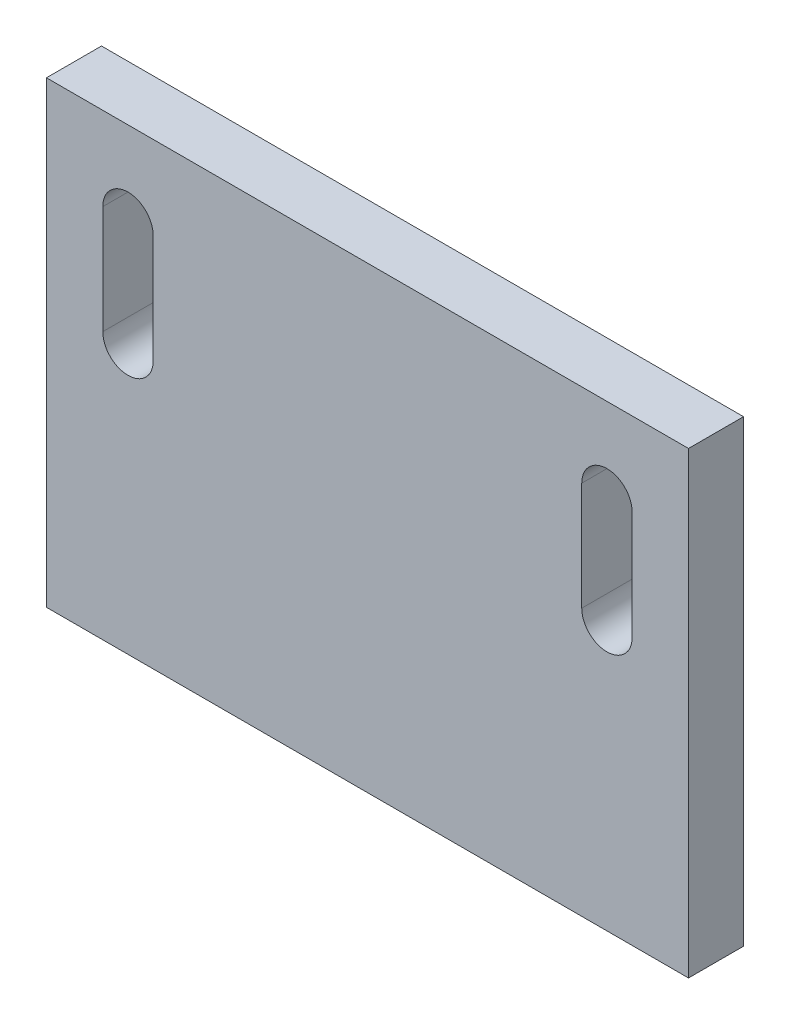
from build123d import *

# Parameters (mm, degrees)
SKETCH1_W           = 70
SKETCH1_H           = 50
BOSS_EXTRUDE1_DEPTH = 6
CUT_EXTRUDE1_DEPTH  = 44.428101501


with BuildPart() as part:
    # Sketch1 → Boss-Extrude1 (new body)
    with BuildSketch(Plane.XY):
        Rectangle(SKETCH1_W, SKETCH1_H)
    extrude(amount=BOSS_EXTRUDE1_DEPTH)

    # Sketch2 → Cut-Extrude1 (cut, through all)
    with BuildSketch(Plane.XY):
        with BuildLine():
            Line((23.36, 4.097243552), (23.36, 15.902756448))
            ThreePointArc((23.36, 15.902756448), (26.11, 18.652756448), (28.86, 15.902756448))
            Line((28.86, 15.902756448), (28.86, 4.097243552))
            ThreePointArc((28.86, 4.097243552), (26.11, 1.347243552), (23.36, 4.097243552))
        make_face()
        with BuildLine():
            Line((-23.36, 4.097243552), (-23.36, 15.902756448))
            ThreePointArc((-23.36, 15.902756448), (-26.11, 18.652756448), (-28.86, 15.902756448))
            Line((-28.86, 15.902756448), (-28.86, 4.097243552))
            ThreePointArc((-28.86, 4.097243552), (-26.11, 1.347243552), (-23.36, 4.097243552))
        make_face()
    extrude(amount=CUT_EXTRUDE1_DEPTH, mode=Mode.SUBTRACT)


solid = part.part
